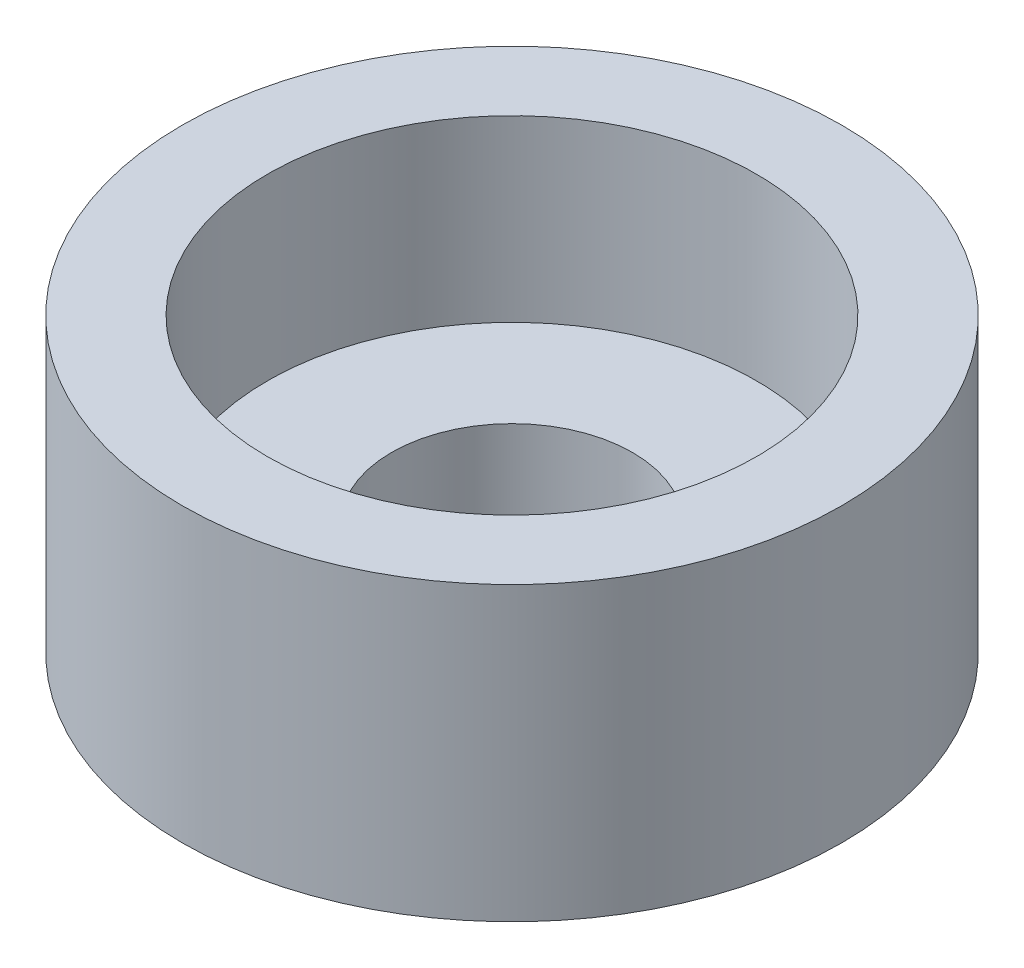
from build123d import *

# Parameters (mm, degrees)
SKETCH1_R           = 35
SKETCH1_R_2         = 12.8
BOSS_EXTRUDE1_DEPTH = 31
SKETCH4_R           = 25.97
CUT_EXTRUDE3_DEPTH  = 19
SKETCH10_R          = 3.025
CUT_EXTRUDE6_DEPTH  = 5.1


with BuildPart() as part:
    # Sketch1 → Boss-Extrude1 (new body)
    with BuildSketch(Plane(origin=(0, 0, 0), x_dir=(1, 0, 0), z_dir=(0, 1, 0))):
        with Locations(Location((0, 0, 0), (0, 0, 270))):
            Circle(SKETCH1_R)
        with Locations(Location((0, 0, 0), (0, 0, 270))):
            Circle(SKETCH1_R_2, mode=Mode.SUBTRACT)
    extrude(amount=BOSS_EXTRUDE1_DEPTH)

    # Sketch4 → Cut-Extrude3 (cut)
    with BuildSketch(Plane(origin=(0, 31, 0), x_dir=(1, 0, 0), z_dir=(0, 1, 0))):
        with Locations(Location((0, 0, 0), (0, 0, 270))):
            Circle(SKETCH4_R)
    extrude(amount=-CUT_EXTRUDE3_DEPTH, mode=Mode.SUBTRACT)

    # Sketch10 → Cut-Extrude6 (cut)
    with BuildSketch(Plane.XZ):
        with Locations(Location((-25.362762045, -1.374882343, 0), (0, 0, 270))):
            Circle(SKETCH10_R)
        with Locations(Location((11.490697986, 22.652237412, 0), (0, 0, 270))):
            Circle(SKETCH10_R)
        with Locations(Location((13.872064059, -21.277355069, 0), (0, 0, 270))):
            Circle(SKETCH10_R)
    extrude(amount=-CUT_EXTRUDE6_DEPTH, mode=Mode.SUBTRACT)


solid = part.part
